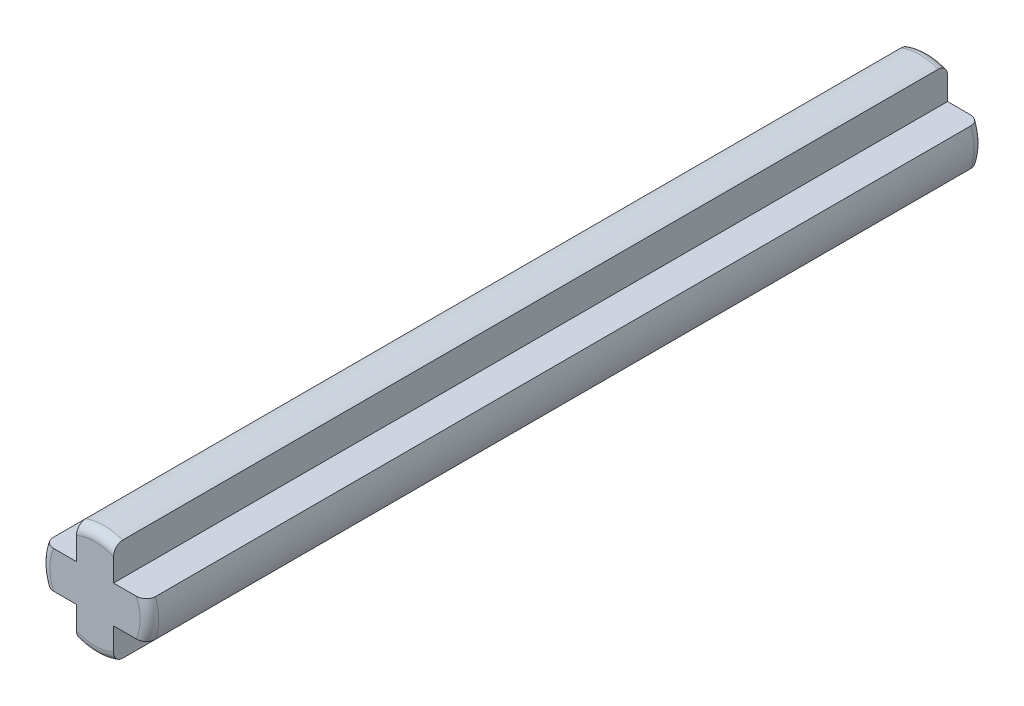
from build123d import *

# Parameters (mm, degrees)
SALIENTE_EXTRUIR1_DEPTH = 36
REDONDEO2_R             = 0.4


with BuildPart() as part:
    # Croquis1 → Saliente-Extruir1 (new body)
    with BuildSketch(Plane.XY):
        with BuildLine():
            Line((0.8, 2.209637979), (0.8, 0.8))
            Line((0.8, 0.8), (2.209637979, 0.8))
            ThreePointArc((2.209637979, 0.8), (2.35, 0), (2.209637979, -0.8))
            Line((2.209637979, -0.8), (0.8, -0.8))
            Line((0.8, -0.8), (0.8, -2.209637979))
            ThreePointArc((0.8, -2.209637979), (0, -2.35), (-0.8, -2.209637979))
            Line((-0.8, -2.209637979), (-0.8, -0.8))
            Line((-0.8, -0.8), (-2.209637979, -0.8))
            ThreePointArc((-2.209637979, -0.8), (-2.35, 0), (-2.209637979, 0.8))
            Line((-2.209637979, 0.8), (-0.8, 0.8))
            Line((-0.8, 0.8), (-0.8, 2.209637979))
            ThreePointArc((-0.8, 2.209637979), (0, 2.35), (0.8, 2.209637979))
        make_face()
    extrude(amount=SALIENTE_EXTRUIR1_DEPTH)

    # Redondeo2
    redondeo2_edges = [part.edges().sort_by_distance(p)[0] for p in [
        (2.35, 0, 0),
        (0, -2.35, 0),
        (-2.35, 0, 0),
        (0, 2.35, 0),
        (-2.35, 0, 36),
        (0, -2.35, 36),
        (2.35, 0, 36),
        (0, 2.35, 36),
    ]]
    fillet(redondeo2_edges, radius=REDONDEO2_R)


solid = part.part
